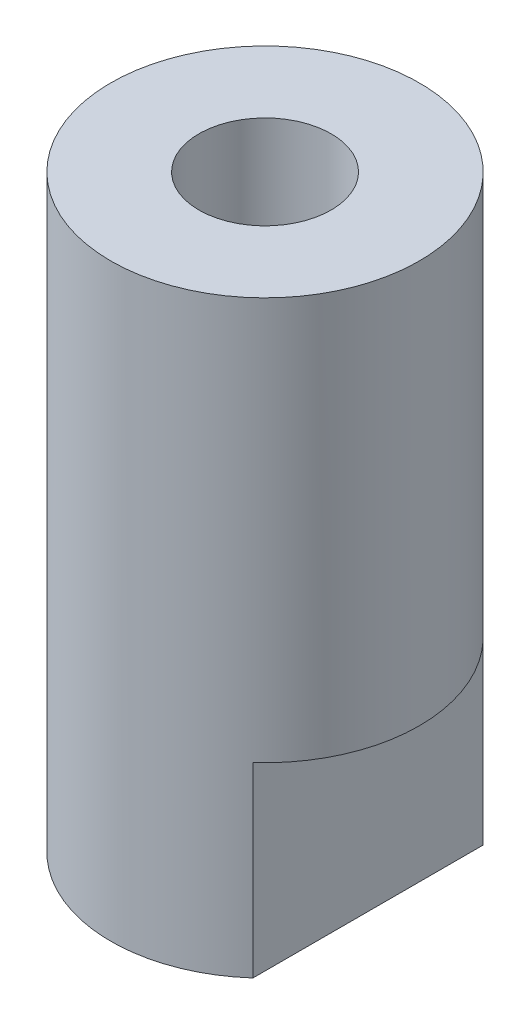
from build123d import *

# Parameters (mm, degrees)
SKETCH1_R                  = 10.5
BOSS_EXTRUDE1_DEPTH        = 40.1
M10X1_0_TAPPED_HOLE1_D     = 9
M10X1_0_TAPPED_HOLE1_DEPTH = 23
M10X1_0_TAPPED_HOLE1_TIP   = 2.703872786
M8X1_0_TAPPED_HOLE1_D      = 7
M8X1_0_TAPPED_HOLE1_DEPTH  = 19
M8X1_0_TAPPED_HOLE1_TIP    = 2.103012167
CUT_EXTRUDE1_DEPTH         = 43.761080435
CUT_EXTRUDE1_DEPTH_BACK    = 43.761080435
SKETCH6_W                  = 3.5
SKETCH6_H                  = 12.7


with BuildPart() as part:
    # Sketch1 → Boss-Extrude1 (new body)
    with BuildSketch(Plane(origin=(0, 0, 0), x_dir=(1, 0, 0), z_dir=(0, 1, 0))):
        with Locations(Location((0, 0, 0), (0, 0, 270))):
            Circle(SKETCH1_R)
    extrude(amount=BOSS_EXTRUDE1_DEPTH)

    # M10x1.0 Tapped Hole1
    with Locations(Plane(origin=(0, 40.1, 0), x_dir=(1, 0, 0), z_dir=(0, 1, 0))):
        with Locations((0, 0)):
            Hole(M10X1_0_TAPPED_HOLE1_D / 2, depth=M10X1_0_TAPPED_HOLE1_DEPTH)
            with Locations((0, 0, -(M10X1_0_TAPPED_HOLE1_DEPTH + M10X1_0_TAPPED_HOLE1_TIP / 2))):  # 118° drill point
                Cone(0, M10X1_0_TAPPED_HOLE1_D / 2, M10X1_0_TAPPED_HOLE1_TIP, mode=Mode.SUBTRACT)

    # M8x1.0 Tapped Hole1
    with Locations(Plane(origin=(0, 0, 0), x_dir=(-1, 0, 0), z_dir=(0, -1, 0))):
        with Locations((0, 0)):
            Hole(M8X1_0_TAPPED_HOLE1_D / 2, depth=M8X1_0_TAPPED_HOLE1_DEPTH)
            with Locations((0, 0, -(M8X1_0_TAPPED_HOLE1_DEPTH + M8X1_0_TAPPED_HOLE1_TIP / 2))):  # 118° drill point
                Cone(0, M8X1_0_TAPPED_HOLE1_D / 2, M8X1_0_TAPPED_HOLE1_TIP, mode=Mode.SUBTRACT)

    # Sketch6 → Cut-Extrude1 (cut, two sides: drawn at the far end of the back side and taken through both)
    with BuildSketch(Plane.XY.offset(-CUT_EXTRUDE1_DEPTH_BACK)):
        with Locations((-8.75, 6.35)):
            Rectangle(SKETCH6_W, SKETCH6_H)
        with Locations((8.75, 6.35)):
            Rectangle(SKETCH6_W, SKETCH6_H)
    extrude(amount=CUT_EXTRUDE1_DEPTH + CUT_EXTRUDE1_DEPTH_BACK, mode=Mode.SUBTRACT)


solid = part.part
